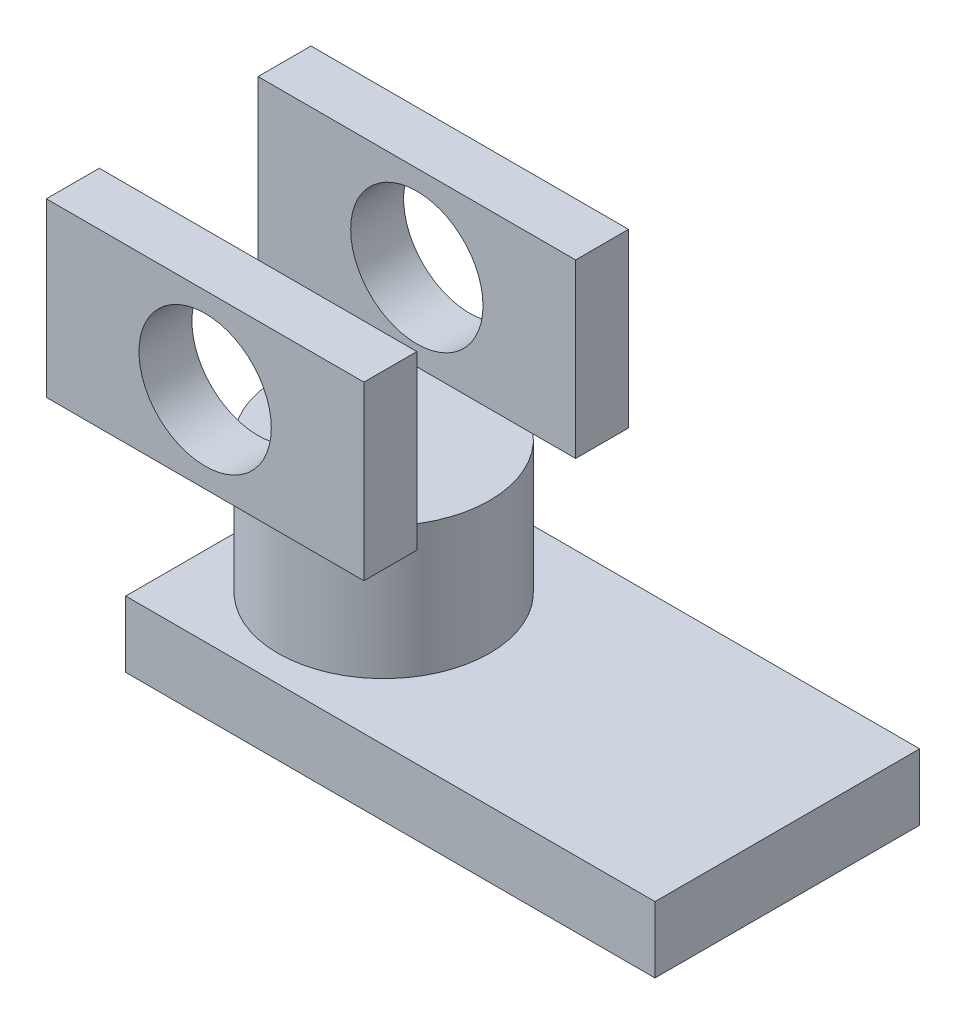
from build123d import *

# Parameters (mm, degrees)
SKETCH1_W           = 40
SKETCH1_H           = 20
BOSS_EXTRUDE1_DEPTH = 5
SKETCH2_R           = 8
BOSS_EXTRUDE2_DEPTH = 10
BOSS_EXTRUDE3_DEPTH = 20
CUT_EXTRUDE1_DEPTH  = 42.952353927
SKETCH6_R           = 5
CUT_EXTRUDE2_DEPTH  = 53.763623833


with BuildPart() as part:
    # Sketch1 → Boss-Extrude1 (new body)
    with BuildSketch(Plane(origin=(0, 0, 0), x_dir=(1, 0, 0), z_dir=(0, 1, 0))):
        with Locations((20, 10)):
            Rectangle(SKETCH1_W, SKETCH1_H)
    extrude(amount=BOSS_EXTRUDE1_DEPTH)

    # Sketch2 → Boss-Extrude2 (add)
    with BuildSketch(Plane(origin=(0, 5, 0), x_dir=(1, 0, 0), z_dir=(0, 1, 0))):
        with Locations(Location((9.5, 10, 0), (0, 0, 270))):
            Circle(SKETCH2_R)
    extrude(amount=BOSS_EXTRUDE2_DEPTH)

    # Sketch4 → Boss-Extrude3 (add, through all)
    with BuildSketch(Plane.XY):
        Polygon((-6, 15), (0, 15), (1.5, 15), (17.5, 15), (18, 15), (18, 28), (-6, 28), align=None)
    extrude(amount=-BOSS_EXTRUDE3_DEPTH)

    # Sketch5 → Cut-Extrude1 (cut, through all)
    with BuildSketch(Plane(origin=(18, 0, 0), x_dir=(0, 0, -1), z_dir=(1, 0, 0))):
        Polygon((10, 15), (16, 15), (16, 28), (4, 28), (4, 15), align=None)
    extrude(amount=-CUT_EXTRUDE1_DEPTH, mode=Mode.SUBTRACT)

    # Sketch6 → Cut-Extrude2 (cut, through all)
    with BuildSketch(Plane.XY):
        with Locations((6, 21.5)):
            Circle(SKETCH6_R)
    extrude(amount=-CUT_EXTRUDE2_DEPTH, mode=Mode.SUBTRACT)


solid = part.part
